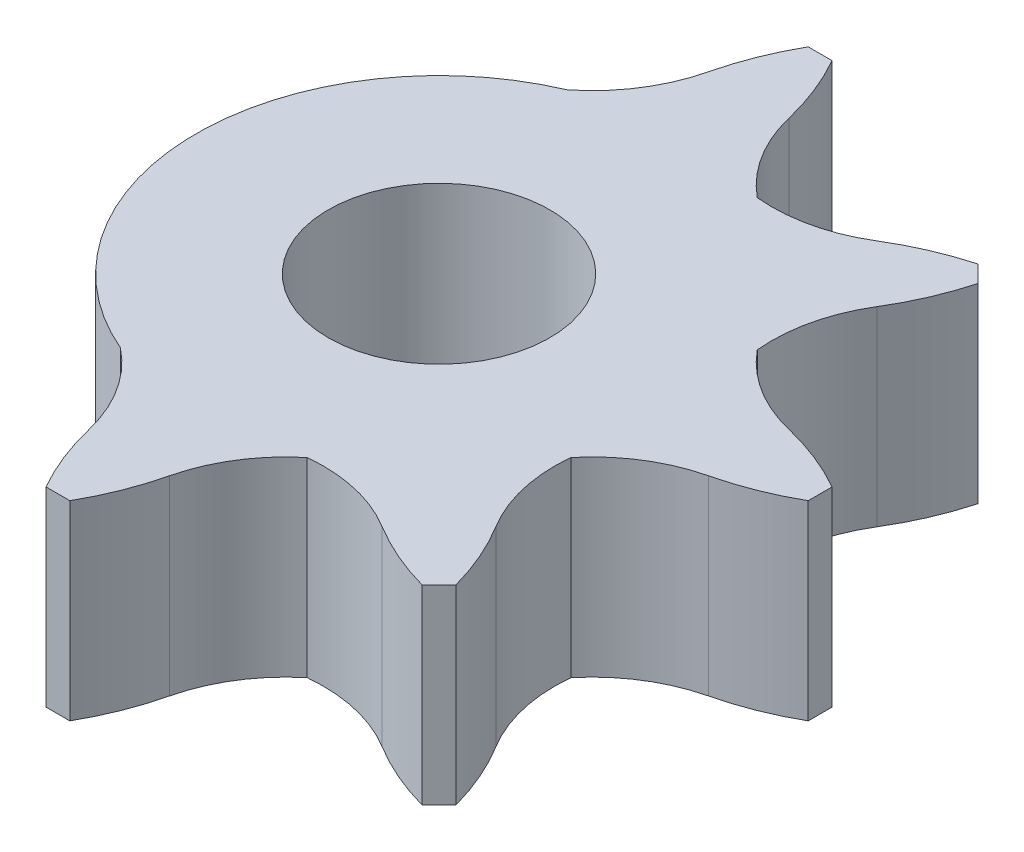
from build123d import *

# Parameters (mm, degrees)
BOSS_EXTRUDE1_DEPTH = 4
CIRPATTERN2_COUNT   = 5
CIRPATTERN2_ANGLE   = 180
BOSS_EXTRUDE3_DEPTH = 4


with BuildPart() as part:
    # Sketch1 → Boss-Extrude1 (new body)
    with BuildSketch(Plane(origin=(0, 0, 0), x_dir=(1, 0, 0), z_dir=(0, 1, 0))):
        with BuildLine():
            Line((0.25, 7.99381848), (-0.25, 7.99381848))
            ThreePointArc((-0.25, 7.99381848), (-0.831305349, 6.545394817), (-1, 4.99381848))
            Line((-1, 4.99381848), (1, 4.99381848))
            ThreePointArc((1, 4.99381848), (0.831305349, 6.545394817), (0.25, 7.99381848))
        make_face()
        with BuildLine():
            Line((0, 6.49381848), (0.843945674, 6.49381848))
            ThreePointArc((0.843945674, 6.49381848), (1.27002788, 5.491773836), (2, 4.683825681))
            Line((2, 4.683825681), (-2, 4.683825681))
            ThreePointArc((-2, 4.683825681), (-1.27002788, 5.491773836), (-0.843945674, 6.49381848))
            Line((-0.843945674, 6.49381848), (0, 6.49381848))
        make_face()
    boss_extrude1 = extrude(amount=BOSS_EXTRUDE1_DEPTH)

    # CirPattern2: Boss-Extrude1 ×5 about axis
    cirpattern2_axis = Axis((0, 0, 0), (0, -1, 0))
    for i in range(1, CIRPATTERN2_COUNT):
        add(boss_extrude1.rotate(cirpattern2_axis, i * CIRPATTERN2_ANGLE / (CIRPATTERN2_COUNT - 1)))

    # Sketch1<5> → Boss-Extrude3 (add)
    with BuildSketch(Plane(origin=(0, 0, 0), x_dir=(1, 0, 0), z_dir=(0, 1, 0))):
        with BuildLine():
            ThreePointArc((5.092958179, 0), (4.249949374, 2.806448526), (2, 4.683825681))
            Line((2, 4.683825681), (-2, 4.683825681))
            ThreePointArc((-2, 4.683825681), (-2.806448526, -4.249949374), (5.092958179, 0))
        make_face()
        with BuildLine():
            ThreePointArc((0.884943501, -2.15), (0.451040464, -2.280830441), (0, -2.325))
            ThreePointArc((0, -2.325), (-0.451040464, -2.280830441), (-0.884943501, -2.15))
            ThreePointArc((-0.884943501, -2.15), (-2.280830441, 0.451040464), (0, 2.325))
            ThreePointArc((0, 2.325), (1.644023266, 1.644023266), (2.325, 0))
            ThreePointArc((2.325, 0), (1.931724442, -1.293856901), (0.884943501, -2.15))
        make_face(mode=Mode.SUBTRACT)
    extrude(amount=BOSS_EXTRUDE3_DEPTH)


solid = part.part
